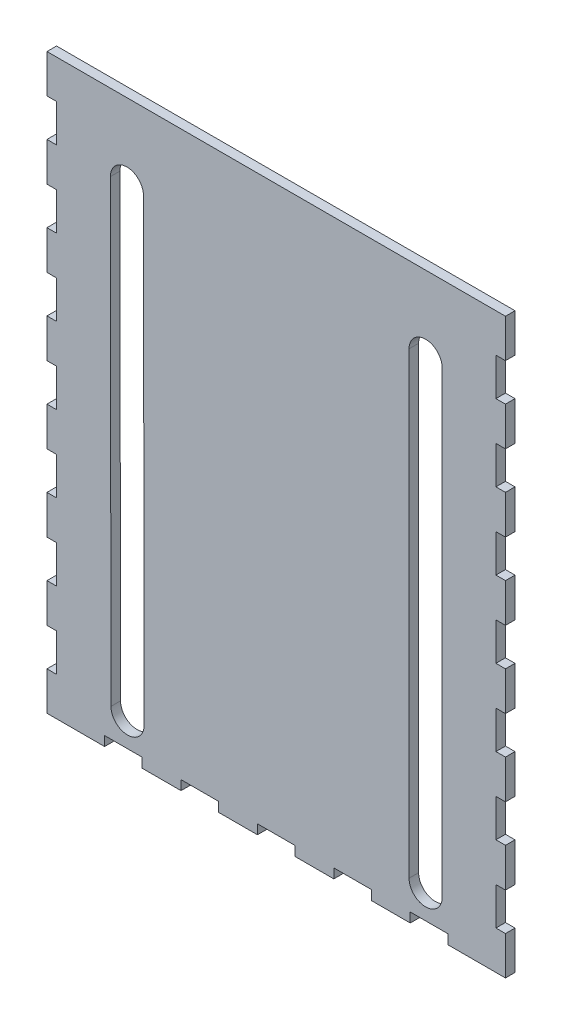
from build123d import *

# Parameters (mm, degrees)
SKETCH1_W           = 304.8
SKETCH1_H           = 381
BOSS_EXTRUDE1_DEPTH = 6.35
SKETCH2_W           = 6.35
SKETCH2_H           = 25.019
SKETCH2_W_2         = 25.019
SKETCH2_H_2         = 6.35
CUT_EXTRUDE3_DEPTH  = 6.35


with BuildPart() as part:
    # Sketch1 → Boss-Extrude1 (new body)
    with BuildSketch(Plane.XY):
        with Locations((152.4, -190.5)):
            Rectangle(SKETCH1_W, SKETCH1_H)
    extrude(amount=BOSS_EXTRUDE1_DEPTH)

    # Sketch2 → Cut-Extrude3 (cut)
    with BuildSketch(Plane.XY):
        with Locations((301.625, -38.1)):
            Rectangle(SKETCH2_W, SKETCH2_H)
        with BuildLine():
            Line((240.70945, -50.8), (240.70945, -355.600000025))
            ThreePointArc((240.70945, -355.600000025), (251.720356878, -366.610893146), (262.73125, -355.599986268))
            Line((262.73125, -355.599986268), (262.73125, -50.8))
            ThreePointArc((262.73125, -50.8), (251.72035, -39.7891), (240.70945, -50.8))
        make_face()
        with Locations((3.175, -38.1)):
            Rectangle(SKETCH2_W, SKETCH2_H)
        with Locations((301.625, -88.9)):
            Rectangle(SKETCH2_W, SKETCH2_H)
        with Locations((301.625, -139.7)):
            Rectangle(SKETCH2_W, SKETCH2_H)
        with Locations((301.625, -190.5)):
            Rectangle(SKETCH2_W, SKETCH2_H)
        with Locations((301.625, -241.3)):
            Rectangle(SKETCH2_W, SKETCH2_H)
        with Locations((301.625, -292.1)):
            Rectangle(SKETCH2_W, SKETCH2_H)
        with Locations((301.625, -342.9)):
            Rectangle(SKETCH2_W, SKETCH2_H)
        with Locations((3.175, -88.9)):
            Rectangle(SKETCH2_W, SKETCH2_H)
        with Locations((3.175, -139.7)):
            Rectangle(SKETCH2_W, SKETCH2_H)
        with Locations((3.175, -190.5)):
            Rectangle(SKETCH2_W, SKETCH2_H)
        with Locations((3.175, -241.3)):
            Rectangle(SKETCH2_W, SKETCH2_H)
        with Locations((3.175, -292.1)):
            Rectangle(SKETCH2_W, SKETCH2_H)
        with Locations((3.175, -342.9)):
            Rectangle(SKETCH2_W, SKETCH2_H)
        with Locations((101.6, -377.825)):
            Rectangle(SKETCH2_W_2, SKETCH2_H_2)
        with Locations((50.8, -377.825)):
            Rectangle(SKETCH2_W_2, SKETCH2_H_2)
        with Locations((152.4, -377.825)):
            Rectangle(SKETCH2_W_2, SKETCH2_H_2)
        with Locations((203.2, -377.825)):
            Rectangle(SKETCH2_W_2, SKETCH2_H_2)
        with Locations((254, -377.825)):
            Rectangle(SKETCH2_W_2, SKETCH2_H_2)
        with BuildLine():
            Line((42.136581375, -50.947063112), (42.542981176, -355.746778447))
            ThreePointArc((42.542981176, -355.746778447), (53.568545713, -366.742994354), (64.56476162, -355.717429817))
            Line((64.56476162, -355.717429817), (64.1583618, -50.917700725))
            ThreePointArc((64.1583618, -50.917700725), (53.132790394, -39.921491706), (42.136581375, -50.947063112))
        make_face()
    extrude(amount=CUT_EXTRUDE3_DEPTH, mode=Mode.SUBTRACT)


solid = part.part
